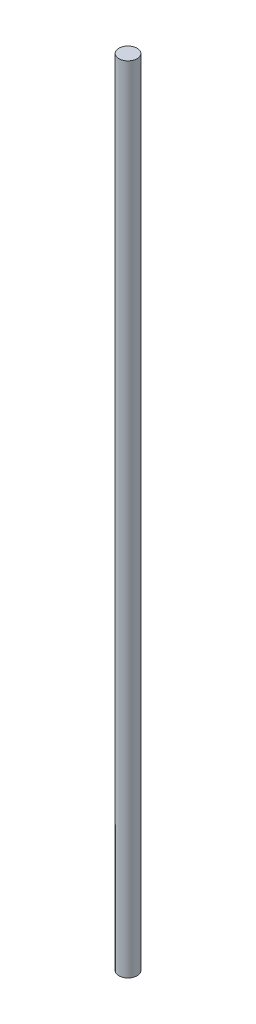
from build123d import *

# Parameters (mm, degrees)
SKETCH1_R           = 6
BOSS_EXTRUDE1_DEPTH = 523.25


with BuildPart() as part:
    # Sketch1 → Boss-Extrude1 (new body)
    with BuildSketch(Plane(origin=(0, 0, 0), x_dir=(1, 0, 0), z_dir=(0, 1, 0))):
        with Locations(Location((0, 0, 0), (0, 0, 270))):
            Circle(SKETCH1_R)
    extrude(amount=BOSS_EXTRUDE1_DEPTH)


solid = part.part
